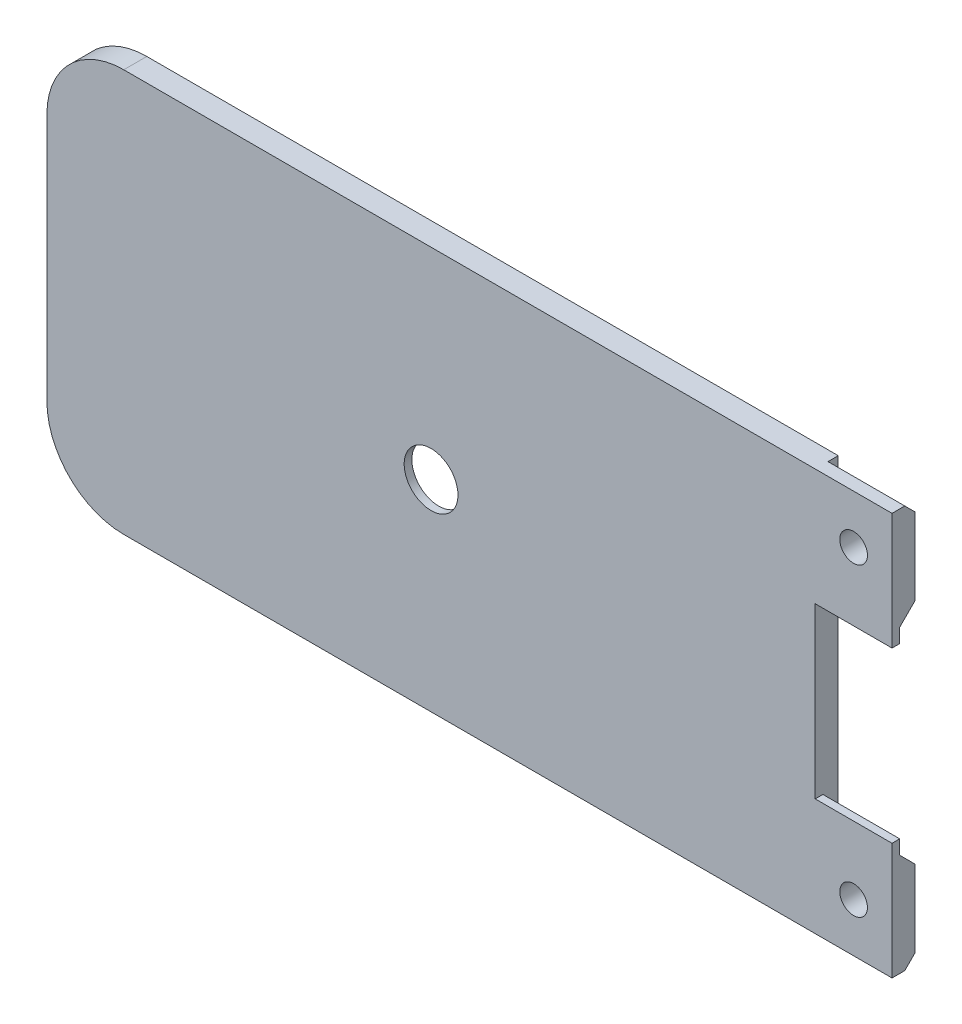
from build123d import *

# Parameters (mm, degrees)
ESBO_O1_W                = 10
ESBO_O1_H                = 15.19
RESSALTO_EXTRUS_O1_DEPTH = 3
CORTE_EXTRUS_O1_DEPTH    = 10
ESBO_O3_R                = 1.8
CORTE_EXTRUS_O2_DEPTH    = 66.535609404
ESBO_O4_R                = 3.5
CORTE_EXTRUS_O3_DEPTH    = 66.535609404
ESBO_O5_R                = 6.5
CORTE_EXTRUS_O4_DEPTH    = 2
FILETE1_R                = 10


with BuildPart() as part:
    # Esboço1 → Ressalto-extrusão1 (new body)
    with BuildSketch(Plane.XY):
        Polygon((-50, -26.19), (50, -26.19), (50, -11), (50, 11), (50, 26.19), (-50, 26.19), align=None)
        with Locations((55, -18.595)):
            Rectangle(ESBO_O1_W, ESBO_O1_H)
        with Locations((55, 18.595)):
            Rectangle(ESBO_O1_W, ESBO_O1_H)
    extrude(amount=RESSALTO_EXTRUS_O1_DEPTH)

    # Esboço2 → Corte-extrusão1 (cut)
    with BuildSketch(Plane(origin=(60, 0, 0), x_dir=(0, 0, -1), z_dir=(1, 0, 0))):
        Polygon((-2, -11), (-2, -12.85), (0, -14.85), (0, -11), align=None)
        Polygon((0, -24.85), (-1.34, -26.19), (0, -26.19), align=None)
        Polygon((0, 11), (0, 14.85), (-2, 12.85), (-2, 11), align=None)
        Polygon((0, 26.19), (0, 24.85), (-1.34, 26.19), align=None)
    extrude(amount=-CORTE_EXTRUS_O1_DEPTH, mode=Mode.SUBTRACT)

    # Esboço3 → Corte-extrusão2 (cut, through all)
    with BuildSketch(Plane(origin=(0, 0, 0), x_dir=(-1, 0, 0), z_dir=(0, 0, -1))):
        with Locations((-55, 19.85)):
            Circle(ESBO_O3_R)
        with Locations(Location((-55, -19.85, 0), (0, 0, 180))):
            Circle(ESBO_O3_R)
    extrude(amount=-CORTE_EXTRUS_O2_DEPTH, mode=Mode.SUBTRACT)

    # Esboço4 → Corte-extrusão3 (cut, through all)
    with BuildSketch(Plane.XY.offset(3)):
        Circle(ESBO_O4_R)
    extrude(amount=-CORTE_EXTRUS_O3_DEPTH, mode=Mode.SUBTRACT)

    # Esboço5 → Corte-extrusão4 (cut)
    with BuildSketch(Plane(origin=(0, 0, 0), x_dir=(-1, 0, 0), z_dir=(0, 0, -1))):
        Circle(ESBO_O5_R)
    extrude(amount=-CORTE_EXTRUS_O4_DEPTH, mode=Mode.SUBTRACT)

    # Filete1
    filete1_edges = [part.edges().sort_by_distance(p)[0] for p in [
        (-50, -26.19, 1.5),
        (-50, 26.19, 1.5),
    ]]
    fillet(filete1_edges, radius=FILETE1_R)


solid = part.part
